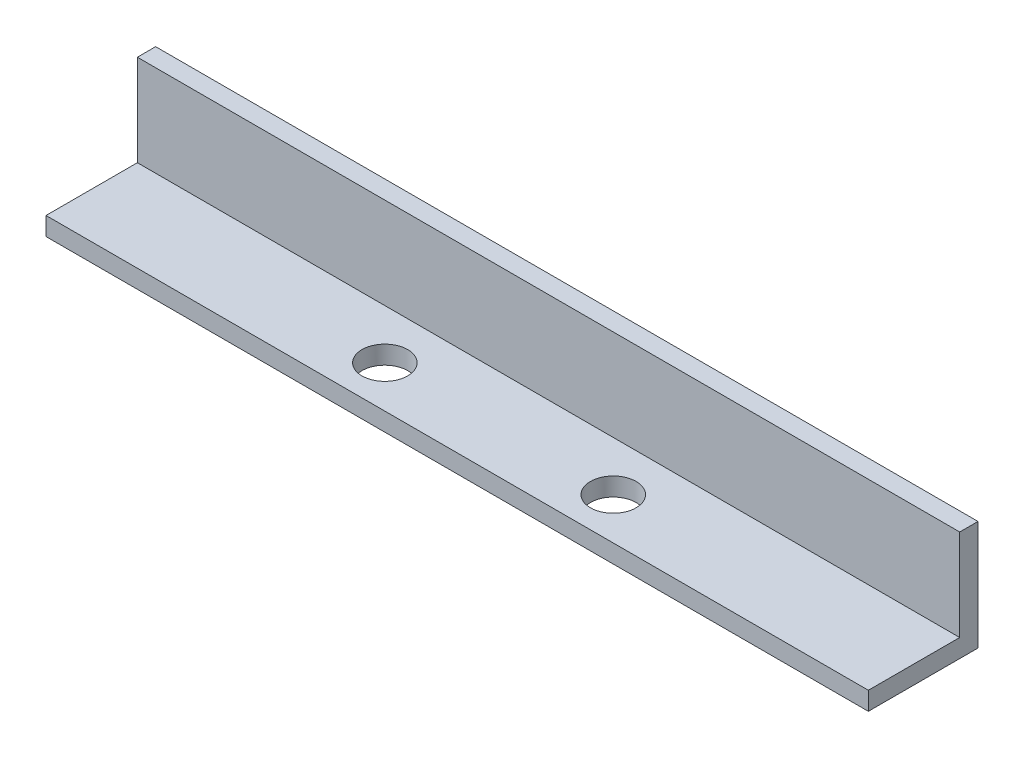
from build123d import *

# Parameters (mm, degrees)
SKETCH1_W               = 90
SKETCH1_H               = 12
BOSS_EXTRUDE1_DEPTH     = 2
SKETCH2_W               = 90
SKETCH2_H               = 2
BOSS_EXTRUDE2_DEPTH     = 10
CUT_EXTRUDE1_DEPTH      = 63.420894383
CUT_EXTRUDE1_DEPTH_BACK = 63.420894383
SKETCH3_R               = 2.5


with BuildPart() as part:
    # Sketch1 → Boss-Extrude1 (new body)
    with BuildSketch(Plane(origin=(0, 0, 0), x_dir=(1, 0, 0), z_dir=(0, 1, 0))):
        with Locations((-16.166666667, 1.416666667)):
            Rectangle(SKETCH1_W, SKETCH1_H)
    extrude(amount=BOSS_EXTRUDE1_DEPTH)

    # Sketch2 → Boss-Extrude2 (add)
    with BuildSketch(Plane(origin=(0, 2, 0), x_dir=(1, 0, 0), z_dir=(0, 1, 0))):
        with Locations((-16.166666667, 6.416666667)):
            Rectangle(SKETCH2_W, SKETCH2_H)
    extrude(amount=BOSS_EXTRUDE2_DEPTH)

    # Sketch3 → Cut-Extrude1 (cut, two sides: drawn at the far end of the back side and taken through both)
    with BuildSketch(Plane(origin=(0, 2, 0), x_dir=(1, 0, 0), z_dir=(0, 1, 0)).offset(-CUT_EXTRUDE1_DEPTH_BACK)):
        with Locations(Location((-28.666666667, 0, 0), (0, 0, 270))):
            Circle(SKETCH3_R)
        with Locations(Location((-3.666666667, 0, 0), (0, 0, 270))):
            Circle(SKETCH3_R)
    extrude(amount=CUT_EXTRUDE1_DEPTH + CUT_EXTRUDE1_DEPTH_BACK, mode=Mode.SUBTRACT)


solid = part.part
